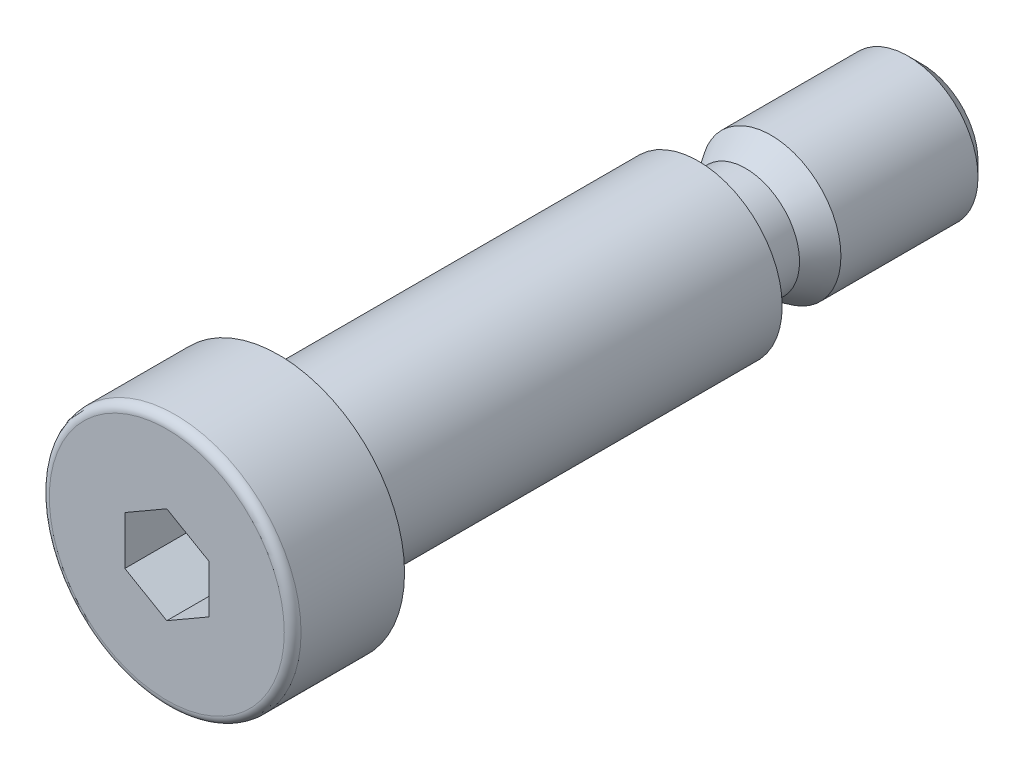
from build123d import *

# Parameters (mm, degrees)
SZKIC1_W                   = 3.85
SZKIC1_H                   = 3.39
WYTNIJ_WYCI_GNI_CIE1_DEPTH = 4.9
ZAOKR_GLENIE1_R            = 0.6


with BuildPart() as part:
    # Szkic1 → Obrót1 (revolve)
    with BuildSketch(Plane(origin=(0, 0, 0), x_dir=(1, 0, 0), z_dir=(0, 1, 0)), mode=Mode.PRIVATE) as obr_t1_sk:
        Polygon((0, -23), (0, -15), (-6, -15), (-9, -15), (-9, -23), align=None)
        Polygon((0, -15), (0, 15), (-3.85, 15), (-6, 15), (-6, -15), align=None)
        with Locations((-1.925, 16.695)):
            Rectangle(SZKIC1_W, SZKIC1_H)
        Polygon((-3.85, 18.39), (0, 18.39), (0, 31), (-4, 31), (-5, 30), (-5, 20.2), align=None)
    revolve(obr_t1_sk.sketch.rotate(Axis((0, 0, 23), (0, 0, -1)), 180), axis=Axis((0, 0, 23), (0, 0, -1)))

    # Szkic2 → Wytnij-wyciągnięcie1 (cut)
    with BuildSketch(Plane.XY.offset(23)):
        Polygon((3, 1.732050808), (0, 3.464101615), (-3, 1.732050808), (-3, -1.732050808), (0, -3.464101615), (3, -1.732050808), align=None)
    extrude(amount=-WYTNIJ_WYCI_GNI_CIE1_DEPTH, mode=Mode.SUBTRACT)

    # Zaokrąglenie1
    zaokr_glenie1_edges = [part.edges().sort_by_distance(p)[0] for p in [
        (-9, 0, 23),
    ]]
    fillet(zaokr_glenie1_edges, radius=ZAOKR_GLENIE1_R)


solid = part.part
